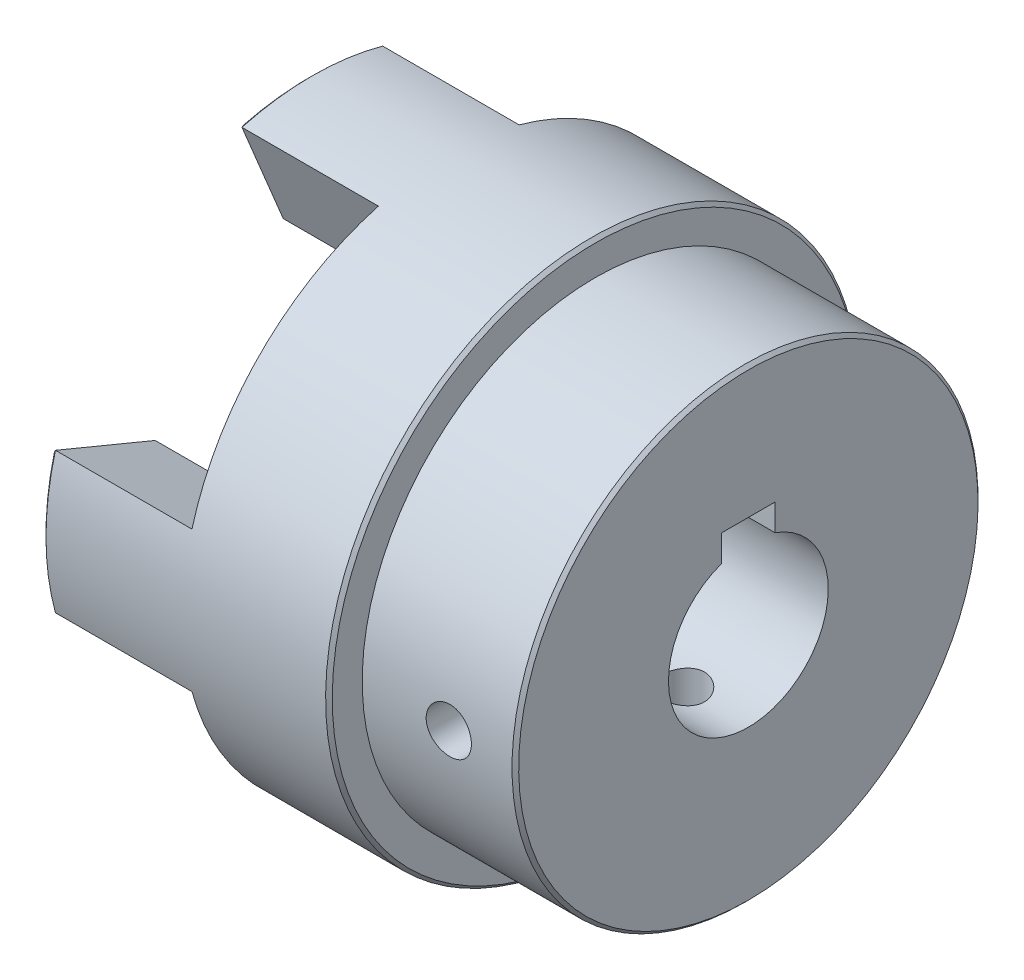
from build123d import *

# Parameters (mm, degrees)
SKETCH2_OUTSIDE_W  = 108.196
SKETCH2_OUTSIDE_H  = 108.196
CUT_EXTRUDE1_DEPTH = 21
CHAMFER1_SIZE      = 0.5
CUT_EXTRUDE2_REACH = 74.284
SKETCH9_W          = 3.4
SKETCH9_H          = 35
CIRPATTERN1_COUNT  = 2
CIRPATTERN1_ANGLE  = 90
CHAMFER2_SIZE      = 0.5


with BuildPart() as part:
    # Sketch1 → Revolve1 (revolve)
    with BuildSketch(Plane.XY, mode=Mode.PRIVATE) as revolve1_sk:
        Polygon((-33, 40), (10, 40), (10, 35), (33, 35), (33, 0), (-33, 0), align=None)
    revolve(revolve1_sk.sketch.rotate(Axis((-33, 0, 0), (1, 0, 0)), 180), axis=Axis((-33, 0, 0), (1, 0, 0)))

    # Sketch2 outside → Cut-Extrude1 (cut)
    with BuildSketch(Plane.ZY.offset(33)):
        Rectangle(SKETCH2_OUTSIDE_W, SKETCH2_OUTSIDE_H)
        with BuildLine():
            Line((-10.56935, 38.578347), (-4.365, 23.59972))
            ThreePointArc((-4.365, 23.59972), (0, 24), (4.365, 23.59972))
            Line((4.365, 23.59972), (10.56935, 38.578347))
            ThreePointArc((10.56935, 38.578347), (0, 40), (-10.56935, 38.578347))
        make_face(mode=Mode.SUBTRACT)
        with BuildLine():
            Line((38.578347, 10.56935), (23.59972, 4.365))
            ThreePointArc((23.59972, 4.365), (24, 0), (23.59972, -4.365))
            Line((23.59972, -4.365), (38.578347, -10.56935))
            ThreePointArc((38.578347, -10.56935), (40, 0), (38.578347, 10.56935))
        make_face(mode=Mode.SUBTRACT)
        with BuildLine():
            Line((10.56935, -38.578347), (4.365, -23.59972))
            ThreePointArc((4.365, -23.59972), (0, -24), (-4.365, -23.59972))
            Line((-4.365, -23.59972), (-10.56935, -38.578347))
            ThreePointArc((-10.56935, -38.578347), (0, -40), (10.56935, -38.578347))
        make_face(mode=Mode.SUBTRACT)
        with BuildLine():
            Line((-38.578347, -10.56935), (-23.59972, -4.365))
            ThreePointArc((-23.59972, -4.365), (-24, 0), (-23.59972, 4.365))
            Line((-23.59972, 4.365), (-38.578347, 10.56935))
            ThreePointArc((-38.578347, 10.56935), (-40, 0), (-38.578347, -10.56935))
        make_face(mode=Mode.SUBTRACT)
    extrude(amount=-CUT_EXTRUDE1_DEPTH, mode=Mode.SUBTRACT)

    # Chamfer1
    chamfer1_edges = [part.edges().sort_by_distance(p)[0] for p in [
        (-33, 0, 40),
        (-33, 40, 0),
        (-33, 0, -40),
        (-33, -39.642993, -5.332267),
        (-33, 31.089033, 7.467175),
        (-33, 24, 0),
        (-33, 31.089033, -7.467175),
        (-33, -7.467175, 31.089033),
        (-33, 0, 24),
        (-33, 7.467175, 31.089033),
        (-33, -31.089033, -7.467175),
        (-33, -24, 0),
        (-33, -31.089033, 7.467175),
        (-33, 7.467175, -31.089033),
        (-33, 0, -24),
        (-33, -7.467175, -31.089033),
    ]]
    chamfer(chamfer1_edges, length=CHAMFER1_SIZE)

    # Sketch3 → Cut-Extrude2 (cut, up to next)
    with BuildSketch(Plane.ZY.offset(12), mode=Mode.PRIVATE) as cut_extrude2_sk1:
        with BuildLine():
            Line((-4, 11.313708), (-4, 15.3))
            Line((-4, 15.3), (4, 15.3))
            Line((4, 15.3), (4, 11.313708))
            ThreePointArc((4, 11.313708), (0, -12), (-4, 11.313708))
        make_face()
    cut_extrude2_tool1 = extrude(cut_extrude2_sk1.sketch, amount=-CUT_EXTRUDE2_REACH, mode=Mode.PRIVATE) & part.part
    add(cut_extrude2_tool1.solids().sort_by_distance((-12, 0.794205, 0))[0], mode=Mode.SUBTRACT)

    # Sketch9 → M8x1.25 Tapped Hole1 (revolve, cut)
    with BuildSketch(Plane.YZ.offset(23)):
        with Locations((1.7, 17.5)):
            Rectangle(SKETCH9_W, SKETCH9_H)
    m8x1_25_tapped_hole1 = revolve(axis=Axis((23, 0, -6.35), (0, 0, 1)), mode=Mode.SUBTRACT)

    # CirPattern1: M8x1.25 Tapped Hole1 ×2 about axis
    cirpattern1_axis = Axis((10, 0, 0), (1, 0, 0))
    for i in range(1, CIRPATTERN1_COUNT):
        add(m8x1_25_tapped_hole1.rotate(cirpattern1_axis, i * CIRPATTERN1_ANGLE / (CIRPATTERN1_COUNT - 1)), mode=Mode.SUBTRACT)

    # Chamfer2
    chamfer2_edges = [part.edges().sort_by_distance(p)[0] for p in [
        (33, 35, 0),
        (10, 40, 0),
    ]]
    chamfer(chamfer2_edges, length=CHAMFER2_SIZE)


solid = part.part
